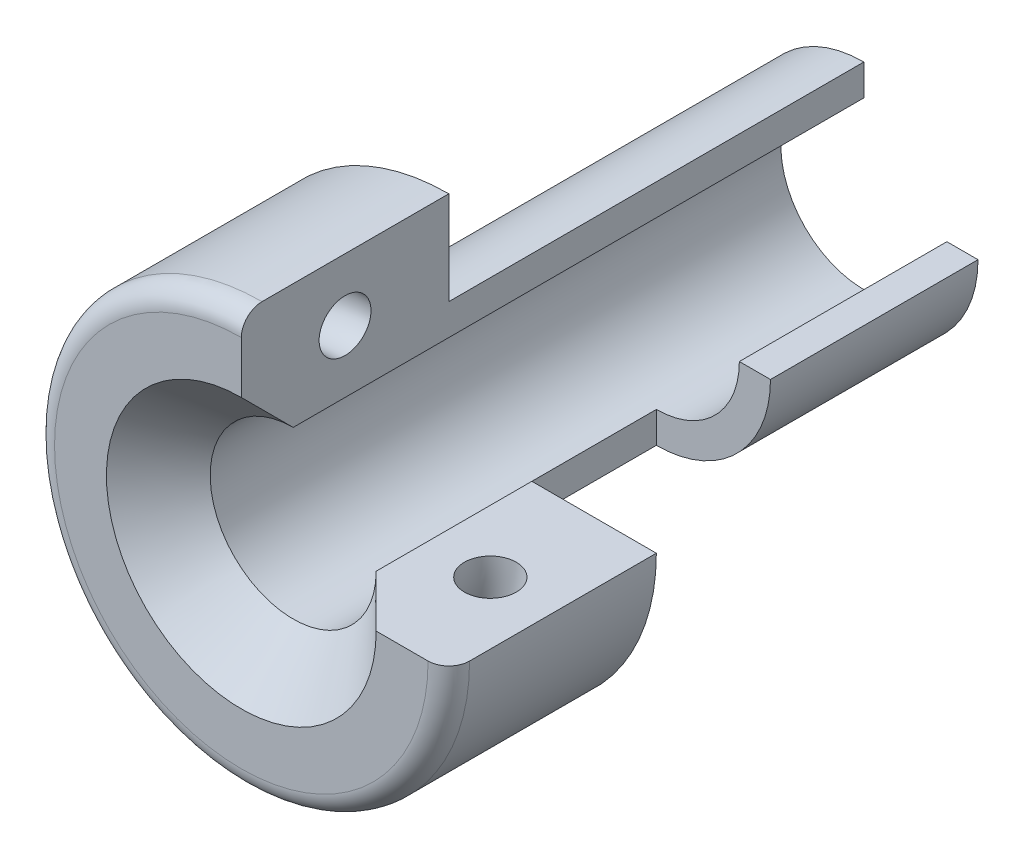
from build123d import *

# Parameters (mm, degrees)
SKETCH6_W      = 20
SKETCH6_H      = 12
SKETCH6_R      = 2.5
SKETCH6_H_2    = 3
REVOLVE3_ANGLE = 270
SKETCH6_3_W    = 40
SKETCH6_3_H    = 3
REVOLVE4_ANGLE = 180
CHAMFER1_SIZE  = 5
FILLET1_R      = 2


with BuildPart() as part:
    # Sketch6 → Revolve3 (revolve)
    # profile 1 of 2: a face of its own
    with BuildSketch(Plane(origin=(0, 0, 0), x_dir=(0, 0, -1), z_dir=(1, 0, 0))):
        with Locations((10, 14)):
            Rectangle(SKETCH6_W, SKETCH6_H)
        with Locations((10, 14)):
            Circle(SKETCH6_R, mode=Mode.SUBTRACT)
    # profile 2 of 2: a face of its own
    with BuildSketch(Plane(origin=(0, 0, 0), x_dir=(0, 0, -1), z_dir=(1, 0, 0))):
        with Locations((50, 9.5)):
            Rectangle(SKETCH6_W, SKETCH6_H_2)
    revolve(axis=Axis((0, 0, 0), (0, 0, 1)), revolution_arc=REVOLVE3_ANGLE)

    # Sketch6<3> → Revolve4 (revolve)
    with BuildSketch(Plane(origin=(0, 0, 0), x_dir=(0, 0, -1), z_dir=(1, 0, 0))):
        with Locations((40, 9.5)):
            Rectangle(SKETCH6_3_W, SKETCH6_3_H)
    revolve(axis=Axis((0, 0, 0), (0, 0, 1)), revolution_arc=REVOLVE4_ANGLE)

    # Chamfer1
    chamfer1_edges = [part.edges().sort_by_distance(p)[0] for p in [
        (-5.656854249, -5.656854249, 0),
    ]]
    chamfer(chamfer1_edges, length=CHAMFER1_SIZE)

    # Fillet1
    fillet1_edges = [part.edges().sort_by_distance(p)[0] for p in [
        (-14.142135624, -14.142135624, 0),
    ]]
    fillet(fillet1_edges, radius=FILLET1_R)


solid = part.part
